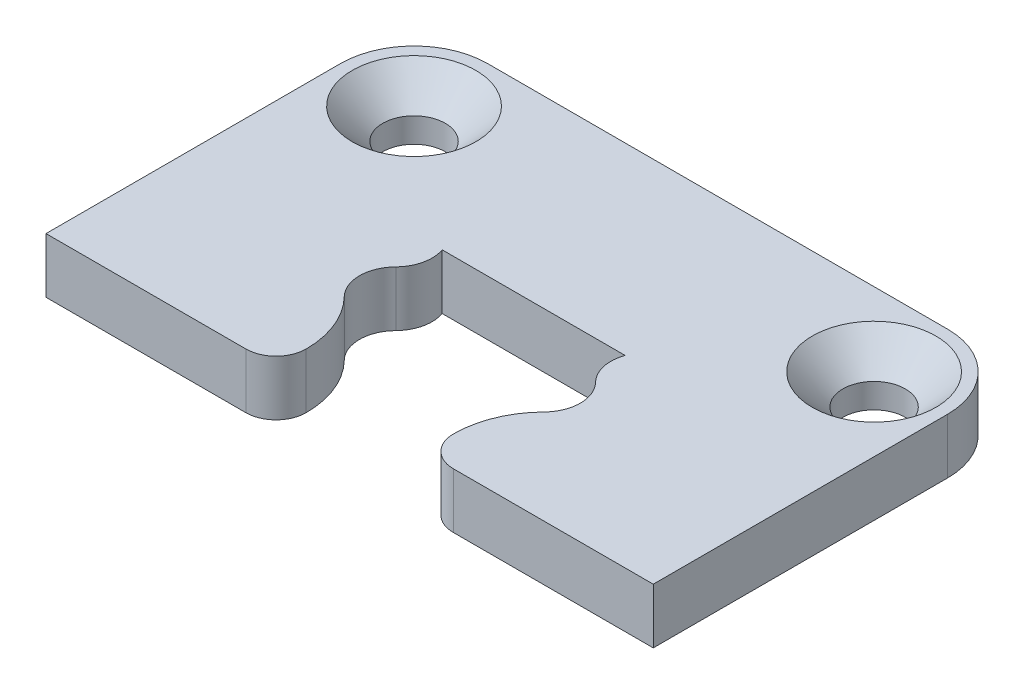
from build123d import *

# Parameters (mm, degrees)
BOSS_EXTRUDE1_DEPTH           = 3
CSK_FOR_M3_SFHCS1_D           = 3.4
CSK_FOR_M3_SFHCS1_DEPTH       = 10
CSK_FOR_M3_SFHCS1_CSINK_D     = 6.72
CSK_FOR_M3_SFHCS1_CSINK_ANGLE = 90
CSK_FOR_M3_SFHCS1_TIP         = 1.021463052
FILLET1_R                     = 4


with BuildPart() as part:
    # Sketch1 → Boss-Extrude1 (new body)
    with BuildSketch(Plane(origin=(0, 0, 0), x_dir=(1, 0, 0), z_dir=(0, 1, 0))):
        with BuildLine():
            Line((-16.5, 20), (16.5, 20))
            Line((16.5, 20), (16.5, 0))
            Line((16.5, 0), (5.636918899, 0))
            ThreePointArc((5.636918899, 0), (4.479442445, 0.479442445), (4, 1.636918899))
            ThreePointArc((4, 1.636918899), (4.370899501, 3.526741264), (5.428571429, 5.13618996))
            ThreePointArc((5.428571429, 5.13618996), (6, 6.535898385), (5.428571429, 7.935606809))
            ThreePointArc((5.428571429, 7.935606809), (4.904567081, 8.902362767), (4.970825238, 10))
            Line((4.970825238, 10), (-4.970825238, 10))
            ThreePointArc((-4.970825238, 10), (-4.904567081, 8.902362767), (-5.428571429, 7.935606809))
            ThreePointArc((-5.428571429, 7.935606809), (-6, 6.535898385), (-5.428571429, 5.13618996))
            ThreePointArc((-5.428571429, 5.13618996), (-4.370899501, 3.526741264), (-4, 1.636918899))
            ThreePointArc((-4, 1.636918899), (-4.479442445, 0.479442445), (-5.636918899, 0))
            Line((-5.636918899, 0), (-16.5, 0))
            Line((-16.5, 0), (-16.5, 20))
        make_face()
    extrude(amount=BOSS_EXTRUDE1_DEPTH)

    # CSK for M3 SFHCS1
    with Locations(Plane(origin=(0, 3, 0), x_dir=(1, 0, 0), z_dir=(0, 1, 0))):
        with Locations((12.5, 16), (-12.5, 16)):
            CounterSinkHole(CSK_FOR_M3_SFHCS1_D / 2, CSK_FOR_M3_SFHCS1_CSINK_D / 2, depth=CSK_FOR_M3_SFHCS1_DEPTH, counter_sink_angle=CSK_FOR_M3_SFHCS1_CSINK_ANGLE)
            with Locations((0, 0, -(CSK_FOR_M3_SFHCS1_DEPTH + CSK_FOR_M3_SFHCS1_TIP / 2))):  # 118° drill point
                Cone(0, CSK_FOR_M3_SFHCS1_D / 2, CSK_FOR_M3_SFHCS1_TIP, mode=Mode.SUBTRACT)

    # Fillet1
    fillet1_edges = [part.edges().sort_by_distance(p)[0] for p in [
        (-16.5, 1.5, -20),
        (16.5, 1.5, -20),
    ]]
    fillet(fillet1_edges, radius=FILLET1_R)


solid = part.part
